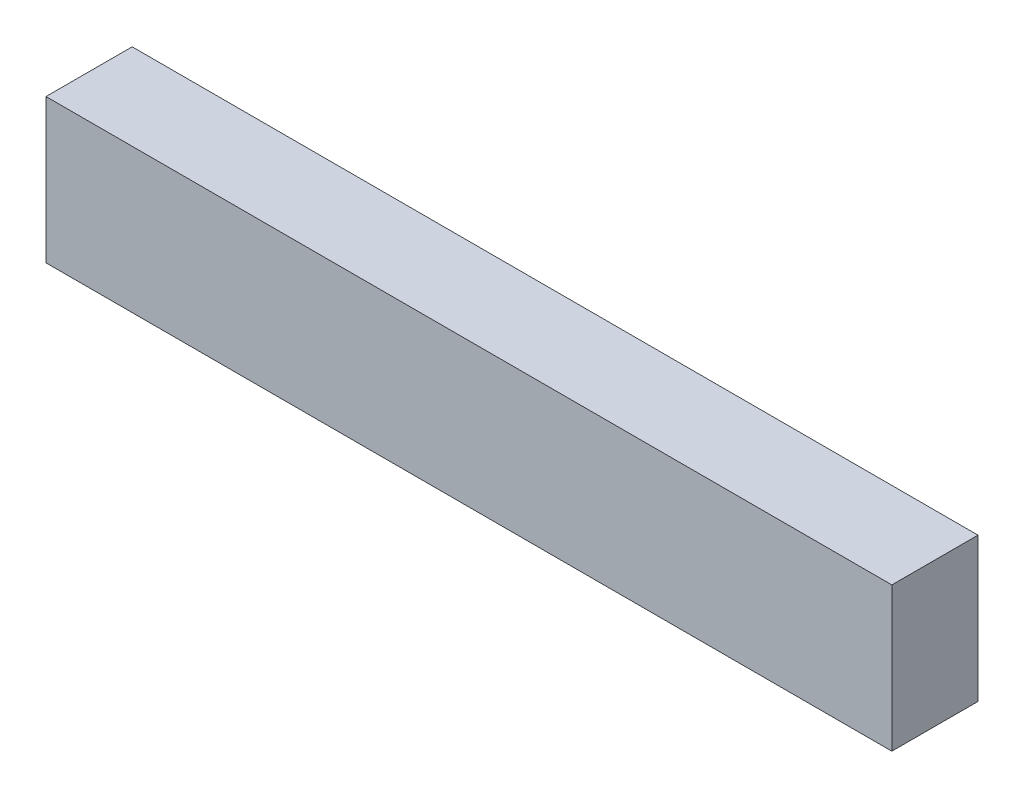
from build123d import *

# Parameters (mm, degrees)
SKETCH1_W                 = 71.18130149
SKETCH1_H                 = 12.121430126
BOSS_EXTRUDE1_DEPTH       = 7.25
SHELL1_T                  = -0.5
SHELL1_THICKNESS_2_FACE_W = 70.18130149
SHELL1_THICKNESS_2_FACE_H = 11.121430126
SHELL1_THICKNESS_2_DEPTH  = 0.3


with BuildPart() as part:
    # Sketch1 → Boss-Extrude1 (new body)
    with BuildSketch(Plane.XY):
        with Locations((-43.446150745, -71.510715063)):
            Rectangle(SKETCH1_W, SKETCH1_H)
    extrude(amount=BOSS_EXTRUDE1_DEPTH)

    # Shell1
    shell1_openings = [part.faces().sort_by_distance(p)[0] for p in [
        (-43.446150745, -71.510715063, 0),
    ]]
    offset(amount=SHELL1_T, openings=shell1_openings, kind=Kind.INTERSECTION)

    # Shell1 thickness 2 face (on inner face of the shell) → Shell1 thickness 2 (cut)
    with BuildSketch(Plane(origin=(-43.446150745, -71.510715063, 6.75), x_dir=(1, 0, 0), z_dir=(0, 0, 1))):
        Rectangle(SHELL1_THICKNESS_2_FACE_W, SHELL1_THICKNESS_2_FACE_H)
    extrude(amount=SHELL1_THICKNESS_2_DEPTH, mode=Mode.SUBTRACT)


solid = part.part
